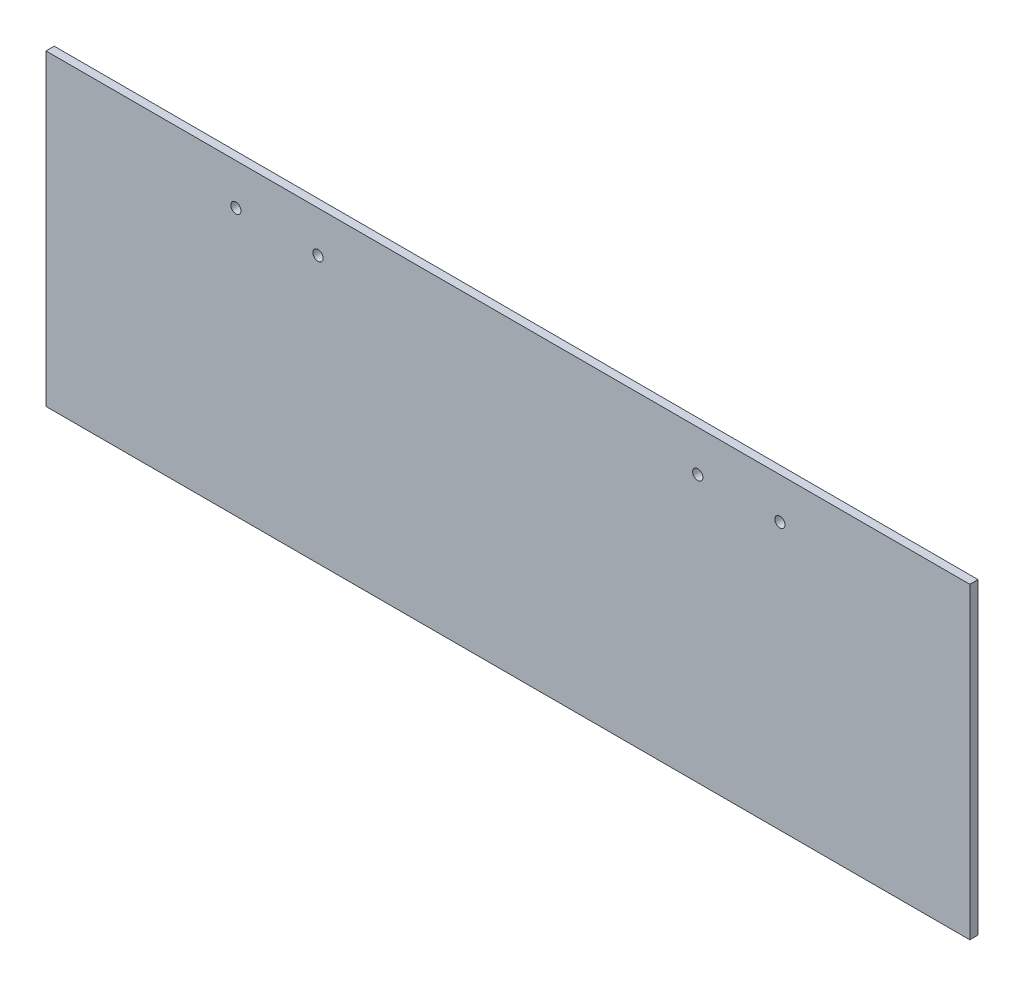
from build123d import *

# Parameters (mm, degrees)
SKETCH1_W               = 450
SKETCH1_H               = 150
BOSS_EXTRUDE1_DEPTH     = 2
TAP_DRILL_FOR_M6_TAP1_D = 5


with BuildPart() as part:
    # Sketch1 → Boss-Extrude1 (new, symmetric)
    with BuildSketch(Plane.XY):
        with Locations((0, 75)):
            Rectangle(SKETCH1_W, SKETCH1_H)
    extrude(amount=BOSS_EXTRUDE1_DEPTH, both=True)

    # Tap Drill for M6 Tap1 (through all)
    with Locations(Plane.XY.offset(2)):
        with Locations((132.5, 130), (-132.5, 130), (-92.5, 130), (92.5, 130)):
            Hole(TAP_DRILL_FOR_M6_TAP1_D / 2)


solid = part.part
